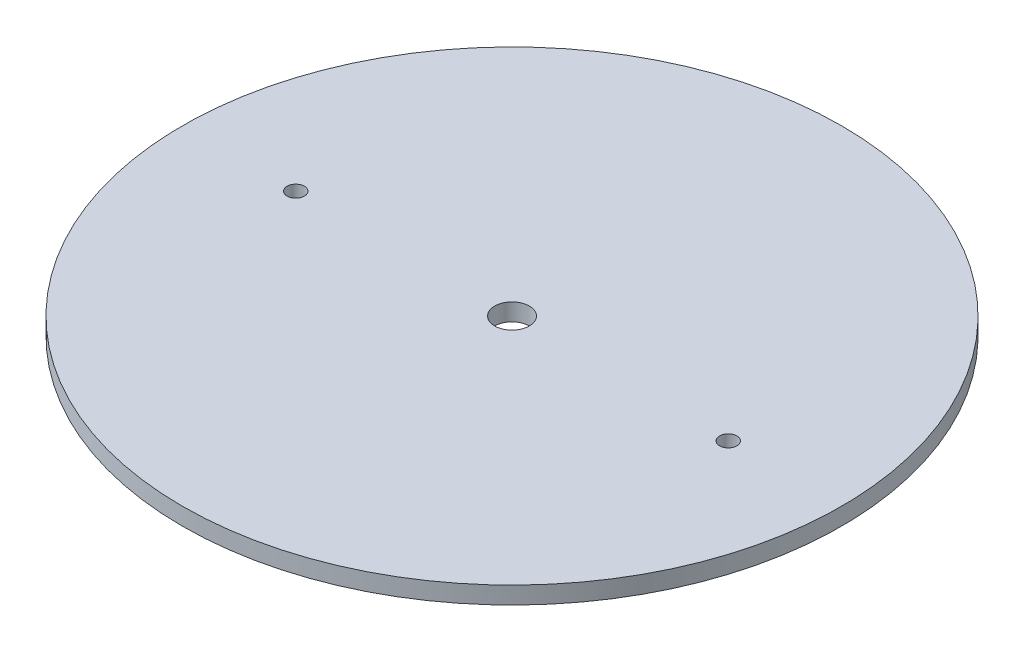
from build123d import *

# Parameters (mm, degrees)
SKETCH1_R           = 76.2
SKETCH1_R_2         = 4
SKETCH1_R_3         = 2
BOSS_EXTRUDE1_DEPTH = 4


with BuildPart() as part:
    # Sketch1 → Boss-Extrude1 (new body)
    with BuildSketch(Plane(origin=(0, 0, 0), x_dir=(1, 0, 0), z_dir=(0, 1, 0))):
        with Locations(Location((0, 0, 0), (0, 0, 270))):
            Circle(SKETCH1_R)
        with Locations(Location((0, 0, 0), (0, 0, 270))):
            Circle(SKETCH1_R_2, mode=Mode.SUBTRACT)
        with Locations(Location((-50, 0, 0), (0, 0, 270))):
            Circle(SKETCH1_R_3, mode=Mode.SUBTRACT)
        with Locations(Location((50, 0, 0), (0, 0, 90))):
            Circle(SKETCH1_R_3, mode=Mode.SUBTRACT)
    extrude(amount=BOSS_EXTRUDE1_DEPTH)


solid = part.part
